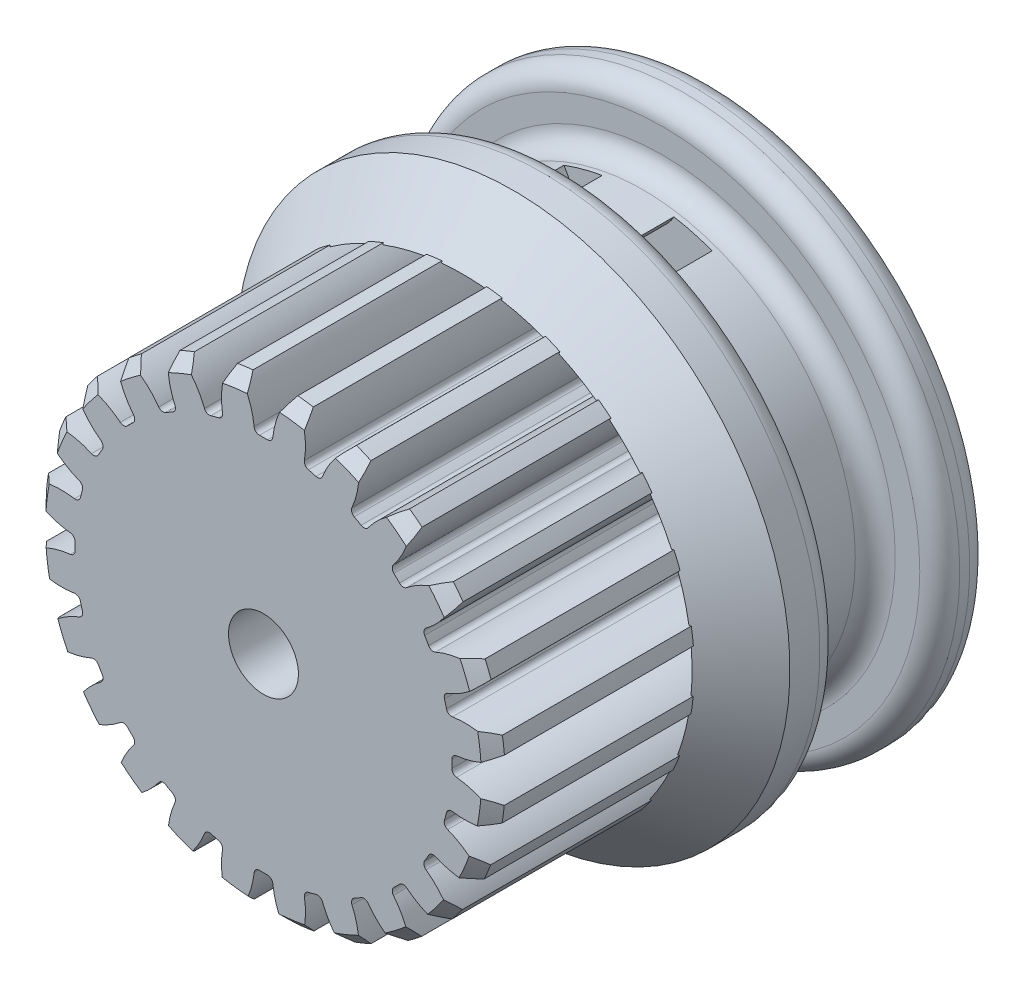
from build123d import *

# Parameters (mm, degrees)
SKETCH1_R                = 23.020833333
BOSS_EXTRUDE1_DEPTH      = 12.5
CUT_EXTRUDE1_DEPTH       = 42.047747012
FILLET1_R                = 0.53125
CHAMFER1_SIZE            = 1.2
CIRPATTERN2_COUNT        = 24
FILLET1_OF_CIRPATTERN2_R = 0.53125
FILLET2_R                = 2
SKETCH5_R                = 7
BOSS_EXTRUDE3_DEPTH      = 10
SKETCH6_R                = 3.5
CUT_EXTRUDE2_DEPTH       = 68.530428081
SKETCH7_R                = 1.725
CUT_EXTRUDE3_DEPTH       = 10
CUT_EXTRUDE4_START       = -25
CUT_EXTRUDE4_DEPTH       = 5


with BuildPart() as part:
    # Sketch1 → Boss-Extrude1 (new, symmetric)
    with BuildSketch(Plane.XY):
        Circle(SKETCH1_R)
    extrude(amount=BOSS_EXTRUDE1_DEPTH, both=True)

    # Sketch2 → Cut-Extrude1 (cut, through all)
    with BuildSketch(Plane.XY.offset(12.5)):
        with BuildLine():
            ThreePointArc((0.896200177, 18.749426905), (0, 18.770833333), (-0.896200177, 18.749426905))
            ThreePointArc((-0.896200177, 18.749426905), (-1.29210701, 20.920212373), (-2.243277711, 22.911273916))
            ThreePointArc((-2.243277711, 22.911273916), (0, 23.020833333), (2.243277711, 22.911273916))
            ThreePointArc((2.243277711, 22.911273916), (1.29210701, 20.920212373), (0.896200177, 18.749426905))
        make_face()
    cut_extrude1 = extrude(amount=-CUT_EXTRUDE1_DEPTH, mode=Mode.SUBTRACT)

    # Fillet1
    fillet1_edges = [part.edges().sort_by_distance(p)[0] for p in [
        (0.896200177, 18.749426905, 0),
        (-0.896200177, 18.749426905, 0),
    ]]
    fillet(fillet1_edges, radius=FILLET1_R)

    # Chamfer1
    chamfer1_edges = [part.edges().sort_by_distance(p)[0] for p in [
        (0, -23.020833333, 12.5),
    ]]
    chamfer(chamfer1_edges, length=CHAMFER1_SIZE)

    # CirPattern2: Cut-Extrude1 ×24 about axis
    cirpattern2_axis = Axis((0, -0.095694461, 0), (0, 0, 1))
    for i in range(1, CIRPATTERN2_COUNT):
        add(cut_extrude1.rotate(cirpattern2_axis, i * 360 / CIRPATTERN2_COUNT), mode=Mode.SUBTRACT)

    # Fillet1 of CirPattern2
    fillet1_of_cirpattern2_edges = [part.edges().sort_by_distance(p)[0] for p in [
        (-4.011813421, 18.33924864, 0),
        (-5.743139213, 17.875341292, 0),
        (-8.646428563, 16.672759468, 0),
        (-10.198692803, 15.776559291, 0),
        (-12.691803888, 13.863527871, 0),
        (-13.959222333, 12.596109427, 0),
        (-15.872253752, 10.102998342, 0),
        (-16.768453929, 8.550734102, 0),
        (-17.971035753, 5.647444752, 0),
        (-18.434943101, 3.91611896, 0),
        (-18.845121366, 0.800505715, 0),
        (-18.845121366, -0.991894638, 0),
        (-18.434943101, -4.107507882, 0),
        (-17.971035753, -5.838833674, 0),
        (-16.768453929, -8.742123025, 0),
        (-15.872253752, -10.294387264, 0),
        (-13.959222333, -12.787498349, 0),
        (-12.691803888, -14.054916794, 0),
        (-10.198692803, -15.967948214, 0),
        (-8.646428563, -16.86414839, 0),
        (-5.743139213, -18.066730215, 0),
        (-4.011813421, -18.530637562, 0),
        (-0.896200177, -18.940815828, 0),
        (0.896200177, -18.940815828, 0),
        (4.011813421, -18.530637562, 0),
        (5.743139213, -18.066730215, 0),
        (8.646428563, -16.86414839, 0),
        (10.198692803, -15.967948214, 0),
        (12.691803888, -14.054916794, 0),
        (13.959222333, -12.787498349, 0),
        (15.872253752, -10.294387264, 0),
        (16.768453929, -8.742123025, 0),
        (17.971035753, -5.838833674, 0),
        (18.434943101, -4.107507882, 0),
        (18.845121366, -0.991894638, 0),
        (18.845121366, 0.800505715, 0),
        (18.434943101, 3.91611896, 0),
        (17.971035753, 5.647444752, 0),
        (16.768453929, 8.550734102, 0),
        (15.872253752, 10.102998342, 0),
        (13.959222333, 12.596109427, 0),
        (12.691803888, 13.863527871, 0),
        (10.198692803, 15.776559291, 0),
        (8.646428563, 16.672759468, 0),
        (5.743139213, 17.875341292, 0),
        (4.011813421, 18.33924864, 0),
    ]]
    fillet(fillet1_of_cirpattern2_edges, radius=FILLET1_OF_CIRPATTERN2_R)

    # Sketch4 → Revolve1 (revolve)
    with BuildSketch(Plane(origin=(0, 0, 0), x_dir=(0, 0, -1), z_dir=(1, 0, 0)), mode=Mode.PRIVATE) as revolve1_sk:
        Polygon((12.5, 27.70702704), (17.5, 27.70702704), (17.5, 21.25), (27.5, 21.25), (27.5, 27.70702704), (32.5, 27.70702704), (32.5, 0), (12.5, 0), (12.5, 22.911273916), (7.5, 22.911273916), align=None)
    revolve(revolve1_sk.sketch.rotate(Axis((0, 0, -32.5), (0, 0, 1)), 90), axis=Axis((0, 0, -32.5), (0, 0, 1)))

    # Fillet2
    fillet2_edges = [part.edges().sort_by_distance(p)[0] for p in [
        (27.70702704, 0, -32.5),
        (27.70702704, 0, -27.5),
        (21.25, 0, -27.5),
        (21.25, 0, -17.5),
        (27.70702704, 0, -17.5),
    ]]
    fillet(fillet2_edges, radius=FILLET2_R)

    # Sketch5 → Boss-Extrude3 (add)
    with BuildSketch(Plane(origin=(0, 0, -32.5), x_dir=(-1, 0, 0), z_dir=(0, 0, -1))):
        with Locations(Location((0, 0, 0), (0, 0, 90))):
            Circle(SKETCH5_R)
    extrude(amount=BOSS_EXTRUDE3_DEPTH)

    # Sketch6 → Cut-Extrude2 (cut, through all)
    with BuildSketch(Plane(origin=(0, 0, -42.5), x_dir=(-1, 0, 0), z_dir=(0, 0, -1))):
        with Locations(Location((0, 0, 0), (0, 0, 90))):
            Circle(SKETCH6_R)
    extrude(amount=-CUT_EXTRUDE2_DEPTH, mode=Mode.SUBTRACT)

    # Sketch7 → Cut-Extrude3 (cut)
    with BuildSketch(Plane(origin=(0, 0, 0), x_dir=(0, 0, -1), z_dir=(1, 0, 0))):
        with Locations((37.5, 0)):
            Circle(SKETCH7_R)
    extrude(amount=-CUT_EXTRUDE3_DEPTH, mode=Mode.SUBTRACT)

    # Sketch8 → Cut-Extrude4 (cut)
    with BuildSketch(Plane.XY.offset(CUT_EXTRUDE4_START)):
        with BuildLine():
            ThreePointArc((-7.420680206, 19.912207444), (-5.529391363, 20.518000174), (-3.589808677, 20.944588171))
            ThreePointArc((-3.589808677, 20.944588171), (0, 18.7790195), (3.589808677, 20.944588171))
            ThreePointArc((3.589808677, 20.944588171), (5.529391363, 20.518000174), (7.420680206, 19.912207444))
            ThreePointArc((7.420680206, 19.912207444), (0, 15.300344273), (-7.420680206, 19.912207444))
        make_face()
    extrude(amount=CUT_EXTRUDE4_DEPTH, mode=Mode.SUBTRACT)


solid = part.part
